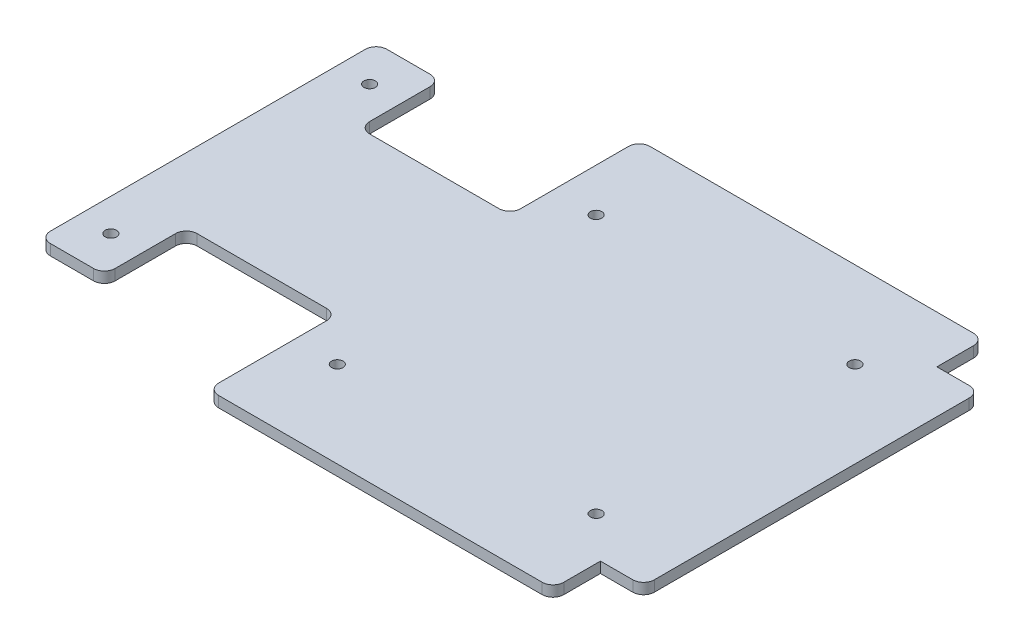
from build123d import *

# Parameters (mm, degrees)
BOSS_EXTRUDE1_DEPTH = 6.35
SKETCH2_R           = 3.3655
CUT_EXTRUDE1_DEPTH  = 262.586090036


with BuildPart() as part:
    # Sketch1 → Boss-Extrude1 (new body)
    with BuildSketch(Plane(origin=(0, 0, 0), x_dir=(1, 0, 0), z_dir=(0, 1, 0))):
        with BuildLine():
            Line((-222.25, 99.06), (-196.85, 99.06))
            ThreePointArc((-196.85, 99.06), (-192.359871939, 97.200128061), (-190.5, 92.71))
            Line((-190.5, 92.71), (-190.5, 57.15))
            ThreePointArc((-190.5, 57.15), (-188.640128061, 52.659871939), (-184.15, 50.8))
            Line((-184.15, 50.8), (-107.95, 50.8))
            ThreePointArc((-107.95, 50.8), (-103.459871939, 52.659871939), (-101.6, 57.15))
            Line((-101.6, 57.15), (-101.6, 120.65))
            ThreePointArc((-101.6, 120.65), (-99.740128061, 125.140128061), (-95.25, 127))
            Line((-95.25, 127), (95.25, 127))
            ThreePointArc((95.25, 127), (99.740128061, 125.140128061), (101.6, 120.65))
            Line((101.6, 120.65), (101.6, 99.06))
            Line((101.6, 99.06), (120.65, 99.06))
            ThreePointArc((120.65, 99.06), (125.14012806, 97.200128061), (127, 92.71))
            Line((127, 92.71), (127, -92.71))
            ThreePointArc((127, -92.71), (125.14012806, -97.200128061), (120.65, -99.06))
            Line((120.65, -99.06), (101.6, -99.06))
            Line((101.6, -99.06), (101.6, -120.65))
            ThreePointArc((101.6, -120.65), (99.740128061, -125.140128061), (95.25, -127))
            Line((95.25, -127), (-95.25, -127))
            ThreePointArc((-95.25, -127), (-99.740128061, -125.140128061), (-101.6, -120.65))
            Line((-101.6, -120.65), (-101.6, -57.15))
            ThreePointArc((-101.6, -57.15), (-103.459871939, -52.659871939), (-107.95, -50.8))
            Line((-107.95, -50.8), (-184.15, -50.8))
            ThreePointArc((-184.15, -50.8), (-188.640128061, -52.659871939), (-190.5, -57.15))
            Line((-190.5, -57.15), (-190.5, -92.71))
            ThreePointArc((-190.5, -92.71), (-192.359871939, -97.200128061), (-196.85, -99.06))
            Line((-196.85, -99.06), (-222.25, -99.06))
            ThreePointArc((-222.25, -99.06), (-226.740128061, -97.200128061), (-228.6, -92.71))
            Line((-228.6, -92.71), (-228.6, 92.71))
            ThreePointArc((-228.6, 92.71), (-226.740128061, 97.200128061), (-222.25, 99.06))
        make_face()
    extrude(amount=BOSS_EXTRUDE1_DEPTH)

    # Sketch2 → Cut-Extrude1 (cut, through all)
    with BuildSketch(Plane(origin=(0, 6.35, 0), x_dir=(1, 0, 0), z_dir=(0, 1, 0))):
        with Locations(Location((-76.2, 76.2, 0), (0, 0, 270))):
            Circle(SKETCH2_R)
        with Locations(Location((76.2, 76.2, 0), (0, 0, 270))):
            Circle(SKETCH2_R)
        with Locations(Location((-76.2, -76.2, 0), (0, 0, 270))):
            Circle(SKETCH2_R)
        with Locations(Location((76.2, -76.2, 0), (0, 0, 270))):
            Circle(SKETCH2_R)
        with Locations(Location((-209.55, 76.2, 0), (0, 0, 270))):
            Circle(SKETCH2_R)
        with Locations(Location((-209.55, -76.2, 0), (0, 0, 270))):
            Circle(SKETCH2_R)
    extrude(amount=-CUT_EXTRUDE1_DEPTH, mode=Mode.SUBTRACT)


solid = part.part
